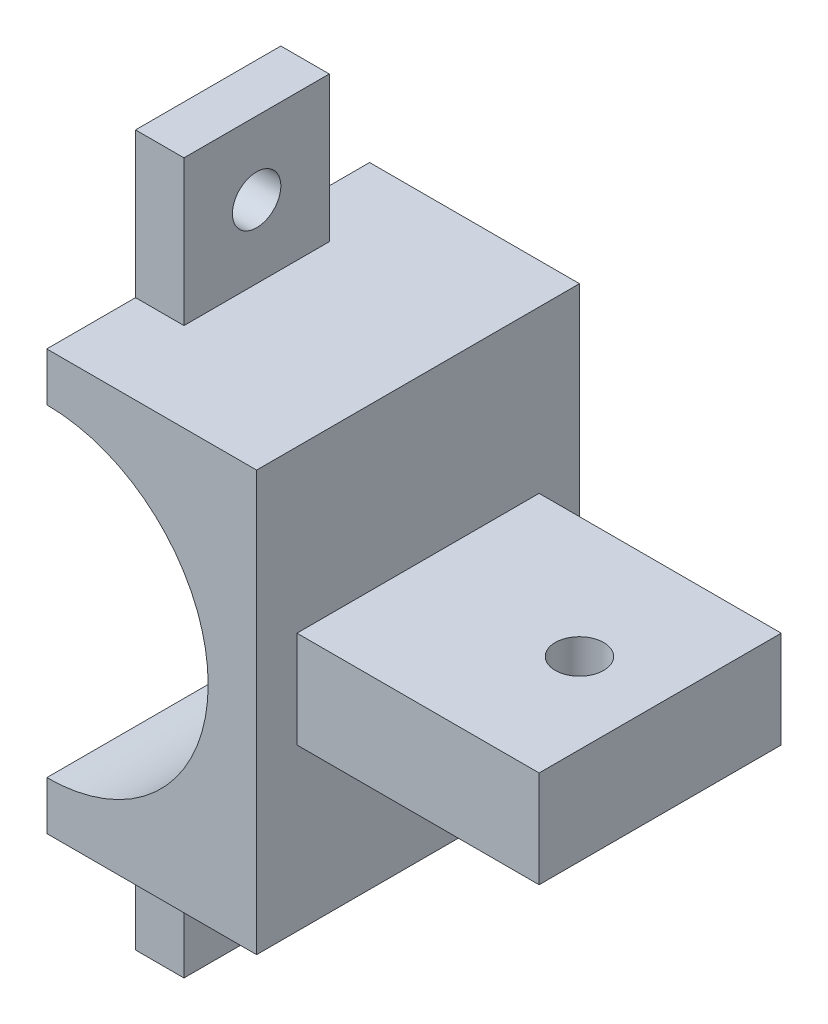
from build123d import *

# Parameters (mm, degrees)
EXTRUDE_1_DEPTH     = 20
SKETCH_7_W          = 9
SKETCH_7_H          = 12
SKETCH_7_R          = 1.5
EXTRUDE_3_DEPTH     = 3
EXTRUDE_4_DEPTH     = 15
SKETCH_9_R          = 1.5
CUT_EXTRUDE_1_DEPTH = 15
SKETCH_6_R          = 1.5
EXTRUDE_2_DEPTH     = 3


with BuildPart() as part:
    # Эскиз1 → Бобышка-Вытянуть1 (new body)
    with BuildSketch(Plane.XY):
        with BuildLine():
            Line((0, 10), (0, 13))
            Line((0, 13), (13, 13))
            Line((13, 13), (13, -13))
            Line((13, -13), (0, -13))
            Line((0, -13), (0, -10))
            ThreePointArc((0, -10), (10, 0), (0, 10))
        make_face()
    extrude(amount=EXTRUDE_1_DEPTH)

    # Эскиз7 → Бобышка-Вытянуть3 (add)
    # profile 1 of 2: a face of its own
    with BuildSketch(Plane.ZY):
        with Locations((10, 16)):
            Rectangle(SKETCH_7_W, SKETCH_7_H)
        with Locations((10, 17.5)):
            Circle(SKETCH_7_R, mode=Mode.SUBTRACT)
    # profile 2 of 2: a face of its own
    with BuildSketch(Plane.ZY):
        with Locations((10, -16)):
            Rectangle(SKETCH_7_W, SKETCH_7_H)
        with Locations((10, -17.5)):
            Circle(SKETCH_7_R, mode=Mode.SUBTRACT)
    extrude(amount=-EXTRUDE_3_DEPTH)

    # Эскиз8 → Бобышка-Вытянуть4 (add)
    with BuildSketch(Plane(origin=(13, 0, 0), x_dir=(0, 0, -1), z_dir=(1, 0, 0))):
        Polygon((-17.5, 3), (-17.5, -3), (-2.5, -3), (-2.5, 3), (-10, 3), align=None)
    extrude(amount=EXTRUDE_4_DEPTH)

    # Эскиз9 → Вырез-Вытянуть1 (cut)
    with BuildSketch(Plane(origin=(0, 3, 0), x_dir=(1, 0, 0), z_dir=(0, 1, 0))):
        with Locations(Location((23, -10, 0), (0, 0, 270))):
            Circle(SKETCH_9_R)
    extrude(amount=-CUT_EXTRUDE_1_DEPTH, mode=Mode.SUBTRACT)

    # Эскиз6 → Бобышка-Вытянуть2 (add)
    # profile 1 of 2: a face of its own
    with BuildSketch(Plane.ZY):
        Polygon((10, 10), (5.5, 10), (5.5, 22), (14.5, 22), (14.5, 10), align=None)
        with Locations((10, 17.5)):
            Circle(SKETCH_6_R, mode=Mode.SUBTRACT)
    # profile 2 of 2: a face of its own
    with BuildSketch(Plane.ZY):
        Polygon((10, -10), (5.5, -10), (5.5, -22), (14.5, -22), (14.5, -10), align=None)
        with Locations((10, -17.5)):
            Circle(SKETCH_6_R, mode=Mode.SUBTRACT)
    extrude(amount=-EXTRUDE_2_DEPTH)


solid = part.part
